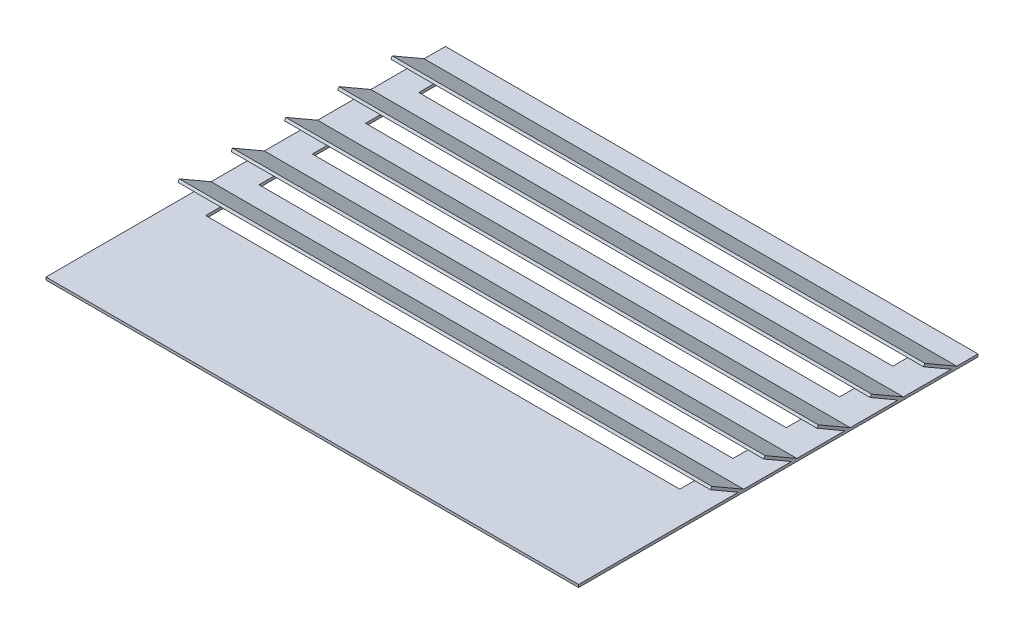
from build123d import *

# Parameters (mm, degrees)
SKETCH_1_W             = 200
SKETCH_1_H             = 150
EXTRUDE_1_DEPTH        = 1
EXTRUDE_2_DEPTH        = 200
PATTERN_LINEAR_1_COUNT = 5
PATTERN_LINEAR_1_PITCH = 20
SKETCH_5_W             = 178
SKETCH_5_H             = 10
CUT_EXTRUDE_1_DEPTH    = 1
PATTERN_LINEAR_2_COUNT = 5
PATTERN_LINEAR_2_PITCH = 20


with BuildPart() as part:
    # 草图1 → 凸台-拉伸1 (new body)
    with BuildSketch(Plane(origin=(0, 0, 0), x_dir=(1, 0, 0), z_dir=(0, 1, 0))):
        with Locations((100, -75)):
            Rectangle(SKETCH_1_W, SKETCH_1_H)
    extrude(amount=EXTRUDE_1_DEPTH)

    # 草图4 → 凸台-拉伸2 (add)
    with BuildSketch(Plane.ZY):
        Polygon((8, 1), (10, 1), (20.467293485, 7.043294711), (19.967293485, 7.909320115), align=None)
    extrude_2 = extrude(amount=-EXTRUDE_2_DEPTH)

    # 阵列(线性)1: 凸台-拉伸2 ×5
    with Locations(*[(0, 0, i * PATTERN_LINEAR_1_PITCH) for i in range(1, PATTERN_LINEAR_1_COUNT)]):
        add(extrude_2)

    # 草图5 → 切除-拉伸1 (cut)
    with BuildSketch(Plane(origin=(0, 1, 0), x_dir=(1, 0, 0), z_dir=(0, 1, 0))):
        with Locations((99, -15)):
            Rectangle(SKETCH_5_W, SKETCH_5_H)
    cut_extrude_1 = extrude(amount=-CUT_EXTRUDE_1_DEPTH, mode=Mode.SUBTRACT)

    # 阵列(线性)2: 切除-拉伸1 ×5
    with Locations(*[(0, 0, i * PATTERN_LINEAR_2_PITCH) for i in range(1, PATTERN_LINEAR_2_COUNT)]):
        add(cut_extrude_1, mode=Mode.SUBTRACT)


solid = part.part
